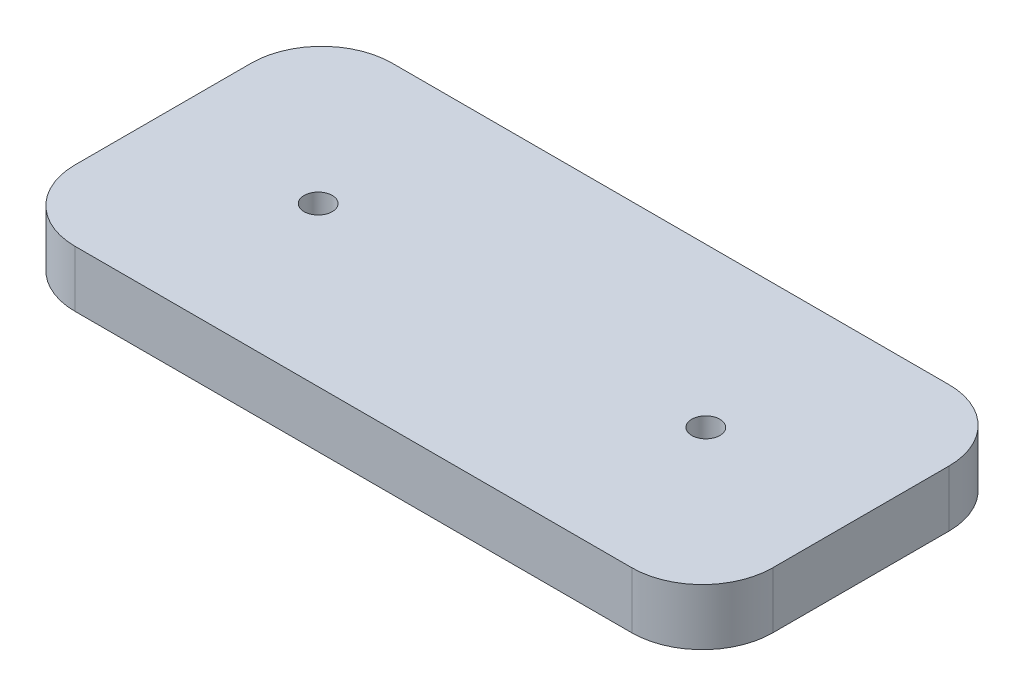
from build123d import *

# Parameters (mm, degrees)
SKETCH1_W           = 99
SKETCH1_H           = 45
SKETCH1_R           = 2
BOSS_EXTRUDE1_DEPTH = 8
FILLET1_R           = 10


with BuildPart() as part:
    # Sketch1 → Boss-Extrude1 (new body)
    with BuildSketch(Plane(origin=(0, 0, 0), x_dir=(1, 0, 0), z_dir=(0, 1, 0))):
        with Locations((49.5, 22.5)):
            Rectangle(SKETCH1_W, SKETCH1_H)
        with Locations(Location((22, 22.5, 0), (0, 0, 270))):
            Circle(SKETCH1_R, mode=Mode.SUBTRACT)
        with Locations(Location((77, 22.5, 0), (0, 0, 90))):
            Circle(SKETCH1_R, mode=Mode.SUBTRACT)
    extrude(amount=BOSS_EXTRUDE1_DEPTH)

    # Fillet1
    fillet1_edges = [part.edges().sort_by_distance(p)[0] for p in [
        (0, 4, -45),
        (99, 4, -45),
        (99, 4, 0),
        (0, 4, 0),
    ]]
    fillet(fillet1_edges, radius=FILLET1_R)


solid = part.part
